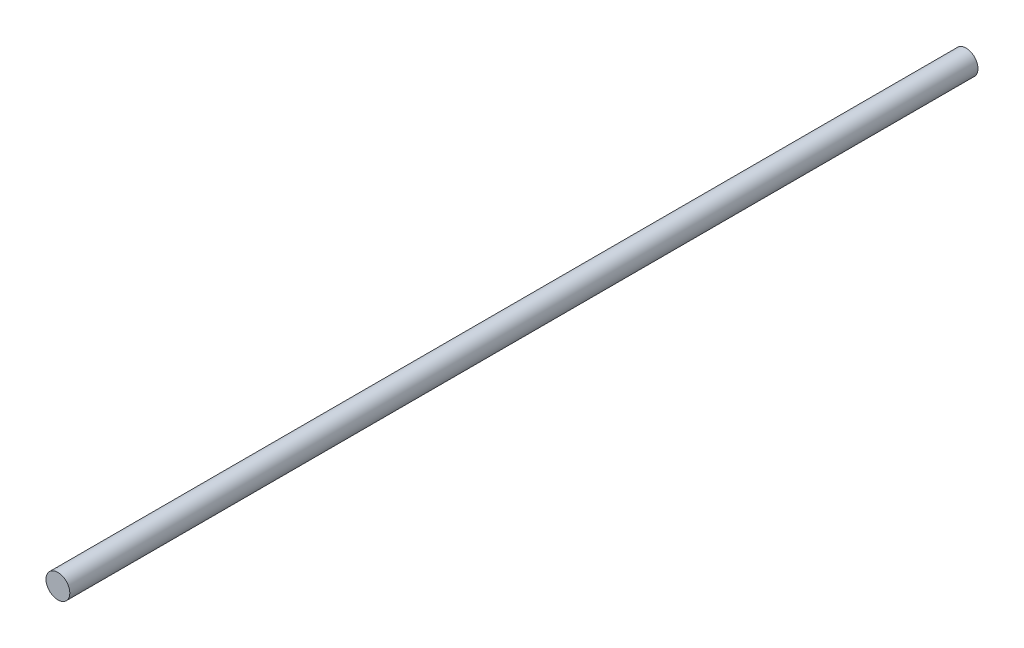
from build123d import *

# Parameters (mm, degrees)
SKETCH1_R           = 5
BOSS_EXTRUDE1_DEPTH = 381


with BuildPart() as part:
    # Sketch1 → Boss-Extrude1 (new body)
    with BuildSketch(Plane.XY):
        Circle(SKETCH1_R)
    extrude(amount=BOSS_EXTRUDE1_DEPTH)


solid = part.part
